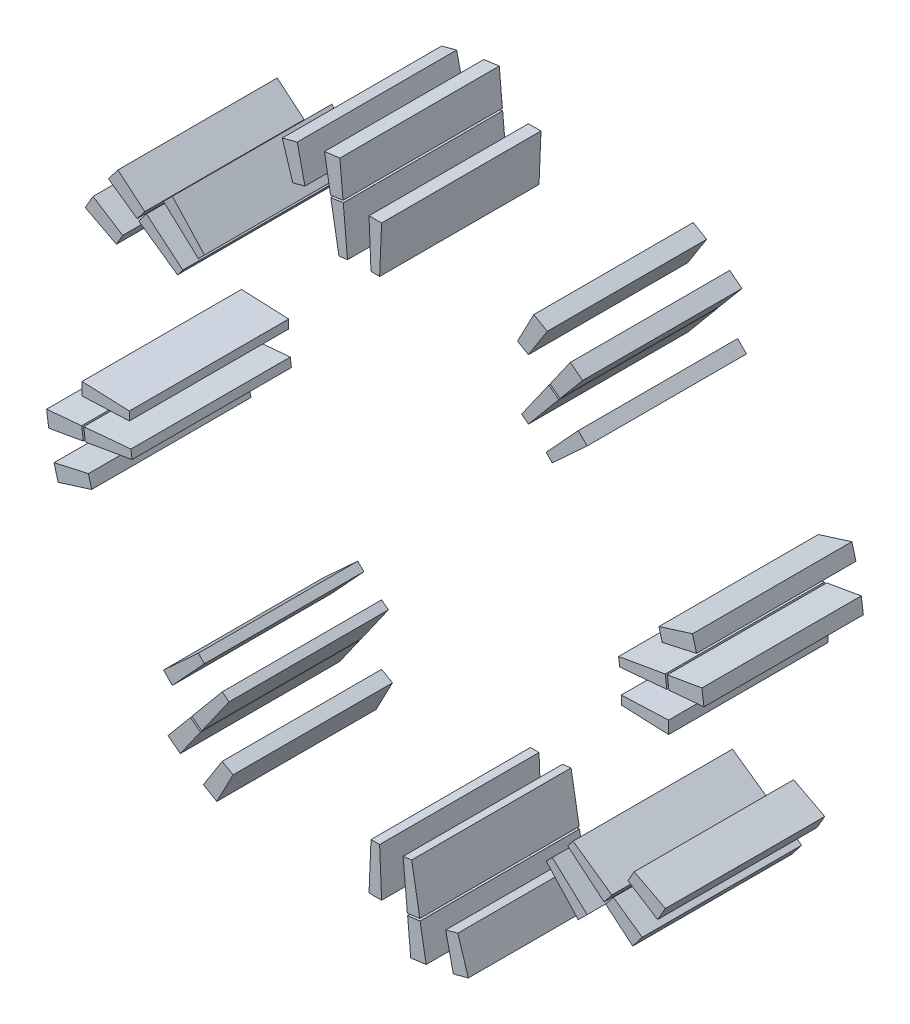
from build123d import *

# Parameters (mm, degrees)
SLOT_COPPER_ENVELOPES_START    = -15
SLOT_COPPER_ENVELOPES_DEPTH    = 30
SLOT_COPPER_ENVELOPES_2_DEPTH  = 30
SLOT_COPPER_ENVELOPES_3_DEPTH  = 30
SLOT_COPPER_ENVELOPES_4_DEPTH  = 30
SLOT_COPPER_ENVELOPES_5_DEPTH  = 30
SLOT_COPPER_ENVELOPES_6_DEPTH  = 30
SLOT_COPPER_ENVELOPES_7_DEPTH  = 30
SLOT_COPPER_ENVELOPES_8_DEPTH  = 30
SLOT_COPPER_ENVELOPES_9_DEPTH  = 30
SLOT_COPPER_ENVELOPES_10_DEPTH = 30
SLOT_COPPER_ENVELOPES_11_DEPTH = 30
SLOT_COPPER_ENVELOPES_12_DEPTH = 30
SLOT_COPPER_ENVELOPES_13_DEPTH = 30
SLOT_COPPER_ENVELOPES_14_DEPTH = 30
SLOT_COPPER_ENVELOPES_15_DEPTH = 30
SLOT_COPPER_ENVELOPES_16_DEPTH = 30
SLOT_COPPER_ENVELOPES_17_DEPTH = 30
SLOT_COPPER_ENVELOPES_18_DEPTH = 30
SLOT_COPPER_ENVELOPES_19_DEPTH = 30
SLOT_COPPER_ENVELOPES_20_DEPTH = 30
SLOT_COPPER_ENVELOPES_21_DEPTH = 30
SLOT_COPPER_ENVELOPES_22_DEPTH = 30
SLOT_COPPER_ENVELOPES_23_DEPTH = 30
SLOT_COPPER_ENVELOPES_24_DEPTH = 30
SLOT_COPPER_ENVELOPES_25_DEPTH = 30
SLOT_COPPER_ENVELOPES_26_DEPTH = 30
SLOT_COPPER_ENVELOPES_27_DEPTH = 30
SLOT_COPPER_ENVELOPES_28_DEPTH = 30
SLOT_COPPER_ENVELOPES_29_DEPTH = 30
SLOT_COPPER_ENVELOPES_30_DEPTH = 30
SLOT_COPPER_ENVELOPES_31_DEPTH = 30
SLOT_COPPER_ENVELOPES_32_DEPTH = 30


with BuildPart() as part:
    # Эскиз1 → Slot_copper_envelopes (new body)
    with BuildSketch(Plane.XY.offset(SLOT_COPPER_ENVELOPES_START)):
        Polygon((46.292870334, -0.8125), (55.2, -1.18280303), (55.2, 1.18280303), (46.292870334, 0.8125), align=None)
    extrude(amount=SLOT_COPPER_ENVELOPES_DEPTH)


with BuildPart() as body_2:
    # Эскиз1 → Slot_copper_envelopes 2 (new body)
    with BuildSketch(Plane.XY.offset(SLOT_COPPER_ENVELOPES_START)):
        Polygon((55.266246148, 6.082929947), (61.858764934, 6.668741046), (61.476975821, 9.568717266), (54.957472596, 8.428297919), align=None)
    extrude(amount=SLOT_COPPER_ENVELOPES_2_DEPTH)


with BuildPart() as body_3:
    # Эскиз1 → Slot_copper_envelopes 3 (new body)
    with BuildSketch(Plane.XY.offset(SLOT_COPPER_ENVELOPES_START)):
        Polygon((46.002880942, 5.236883142), (54.882143124, 6.032361824), (54.573369572, 8.377729797), (45.79077588, 6.847981041), align=None)
    extrude(amount=SLOT_COPPER_ENVELOPES_3_DEPTH)


with BuildPart() as body_4:
    # Эскиз1 → Slot_copper_envelopes 4 (new body)
    with BuildSketch(Plane.XY.offset(SLOT_COPPER_ENVELOPES_START)):
        Polygon((53.999454067, 13.244582306), (60.459109249, 14.685878084), (59.702063542, 17.511211126), (53.387190165, 15.529582294), align=None)
    extrude(amount=SLOT_COPPER_ENVELOPES_4_DEPTH)


with BuildPart() as body_5:
    # Эскиз1 → Slot_copper_envelopes 5 (new body)
    with BuildSketch(Plane.XY.offset(SLOT_COPPER_ENVELOPES_START)):
        Polygon((33.308526793, 32.159478274), (39.868662365, 38.195926278), (38.195926278, 39.868662365), (32.159478274, 33.308526793), align=None)
    extrude(amount=SLOT_COPPER_ENVELOPES_5_DEPTH)


with BuildPart() as body_6:
    # Эскиз1 → Slot_copper_envelopes 6 (new body)
    with BuildSketch(Plane.XY.offset(SLOT_COPPER_ENVELOPES_START)):
        Polygon((34.777856407, 43.380418437), (39.025240145, 48.456264176), (36.704681624, 50.236891356), (32.901094937, 44.820508162), align=None)
    extrude(amount=SLOT_COPPER_ENVELOPES_6_DEPTH)


with BuildPart() as body_7:
    # Эскиз1 → Slot_copper_envelopes 7 (new body)
    with BuildSketch(Plane.XY.offset(SLOT_COPPER_ENVELOPES_START)):
        Polygon((28.825913486, 36.23198465), (34.542011616, 43.073059521), (32.665250146, 44.513149247), (27.536714308, 37.221221972), align=None)
    extrude(amount=SLOT_COPPER_ENVELOPES_7_DEPTH)


with BuildPart() as body_8:
    # Эскиз1 → Slot_copper_envelopes 8 (new body)
    with BuildSketch(Plane.XY.offset(SLOT_COPPER_ENVELOPES_START)):
        Polygon((28.818046189, 47.548714114), (32.366562153, 53.135530115), (29.833437847, 54.598030115), (26.769371245, 48.731517144), align=None)
    extrude(amount=SLOT_COPPER_ENVELOPES_8_DEPTH)


with BuildPart() as body_9:
    # Эскиз1 → Slot_copper_envelopes 9 (new body)
    with BuildSketch(Plane.XY.offset(SLOT_COPPER_ENVELOPES_START)):
        Polygon((0.8125, 46.292870334), (1.18280303, 55.2), (-1.18280303, 55.2), (-0.8125, 46.292870334), align=None)
    extrude(amount=SLOT_COPPER_ENVELOPES_9_DEPTH)


with BuildPart() as body_10:
    # Эскиз1 → Slot_copper_envelopes 10 (new body)
    with BuildSketch(Plane.XY.offset(SLOT_COPPER_ENVELOPES_START)):
        Polygon((-6.082929947, 55.266246148), (-6.668741046, 61.858764934), (-9.568717266, 61.476975821), (-8.428297919, 54.957472596), align=None)
    extrude(amount=SLOT_COPPER_ENVELOPES_10_DEPTH)


with BuildPart() as body_11:
    # Эскиз1 → Slot_copper_envelopes 11 (new body)
    with BuildSketch(Plane.XY.offset(SLOT_COPPER_ENVELOPES_START)):
        Polygon((-5.236883142, 46.002880942), (-6.032361824, 54.882143124), (-8.377729797, 54.573369572), (-6.847981041, 45.79077588), align=None)
    extrude(amount=SLOT_COPPER_ENVELOPES_11_DEPTH)


with BuildPart() as body_12:
    # Эскиз1 → Slot_copper_envelopes 12 (new body)
    with BuildSketch(Plane.XY.offset(SLOT_COPPER_ENVELOPES_START)):
        Polygon((-13.244582306, 53.999454067), (-14.685878084, 60.459109249), (-17.511211126, 59.702063542), (-15.529582294, 53.387190165), align=None)
    extrude(amount=SLOT_COPPER_ENVELOPES_12_DEPTH)


with BuildPart() as body_13:
    # Эскиз1 → Slot_copper_envelopes 13 (new body)
    with BuildSketch(Plane.XY.offset(SLOT_COPPER_ENVELOPES_START)):
        Polygon((-32.159478274, 33.308526793), (-38.195926278, 39.868662365), (-39.868662365, 38.195926278), (-33.308526793, 32.159478274), align=None)
    extrude(amount=SLOT_COPPER_ENVELOPES_13_DEPTH)


with BuildPart() as body_14:
    # Эскиз1 → Slot_copper_envelopes 14 (new body)
    with BuildSketch(Plane.XY.offset(SLOT_COPPER_ENVELOPES_START)):
        Polygon((-43.380418437, 34.777856407), (-48.456264176, 39.025240145), (-50.236891356, 36.704681624), (-44.820508162, 32.901094937), align=None)
    extrude(amount=SLOT_COPPER_ENVELOPES_14_DEPTH)


with BuildPart() as body_15:
    # Эскиз1 → Slot_copper_envelopes 15 (new body)
    with BuildSketch(Plane.XY.offset(SLOT_COPPER_ENVELOPES_START)):
        Polygon((-36.23198465, 28.825913486), (-43.073059521, 34.542011616), (-44.513149247, 32.665250146), (-37.221221972, 27.536714308), align=None)
    extrude(amount=SLOT_COPPER_ENVELOPES_15_DEPTH)


with BuildPart() as body_16:
    # Эскиз1 → Slot_copper_envelopes 16 (new body)
    with BuildSketch(Plane.XY.offset(SLOT_COPPER_ENVELOPES_START)):
        Polygon((-47.548714114, 28.818046189), (-53.135530115, 32.366562153), (-54.598030115, 29.833437847), (-48.731517144, 26.769371245), align=None)
    extrude(amount=SLOT_COPPER_ENVELOPES_16_DEPTH)


with BuildPart() as body_17:
    # Эскиз1 → Slot_copper_envelopes 17 (new body)
    with BuildSketch(Plane.XY.offset(SLOT_COPPER_ENVELOPES_START)):
        Polygon((-46.292870334, 0.8125), (-55.2, 1.18280303), (-55.2, -1.18280303), (-46.292870334, -0.8125), align=None)
    extrude(amount=SLOT_COPPER_ENVELOPES_17_DEPTH)


with BuildPart() as body_18:
    # Эскиз1 → Slot_copper_envelopes 18 (new body)
    with BuildSketch(Plane.XY.offset(SLOT_COPPER_ENVELOPES_START)):
        Polygon((-55.266246148, -6.082929947), (-61.858764934, -6.668741046), (-61.476975821, -9.568717266), (-54.957472596, -8.428297919), align=None)
    extrude(amount=SLOT_COPPER_ENVELOPES_18_DEPTH)


with BuildPart() as body_19:
    # Эскиз1 → Slot_copper_envelopes 19 (new body)
    with BuildSketch(Plane.XY.offset(SLOT_COPPER_ENVELOPES_START)):
        Polygon((-46.002880942, -5.236883142), (-54.882143124, -6.032361824), (-54.573369572, -8.377729797), (-45.79077588, -6.847981041), align=None)
    extrude(amount=SLOT_COPPER_ENVELOPES_19_DEPTH)


with BuildPart() as body_20:
    # Эскиз1 → Slot_copper_envelopes 20 (new body)
    with BuildSketch(Plane.XY.offset(SLOT_COPPER_ENVELOPES_START)):
        Polygon((-53.999454067, -13.244582306), (-60.459109249, -14.685878084), (-59.702063542, -17.511211126), (-53.387190165, -15.529582294), align=None)
    extrude(amount=SLOT_COPPER_ENVELOPES_20_DEPTH)


with BuildPart() as body_21:
    # Эскиз1 → Slot_copper_envelopes 21 (new body)
    with BuildSketch(Plane.XY.offset(SLOT_COPPER_ENVELOPES_START)):
        Polygon((-33.308526793, -32.159478274), (-39.868662365, -38.195926278), (-38.195926278, -39.868662365), (-32.159478274, -33.308526793), align=None)
    extrude(amount=SLOT_COPPER_ENVELOPES_21_DEPTH)


with BuildPart() as body_22:
    # Эскиз1 → Slot_copper_envelopes 22 (new body)
    with BuildSketch(Plane.XY.offset(SLOT_COPPER_ENVELOPES_START)):
        Polygon((-34.777856407, -43.380418437), (-39.025240145, -48.456264176), (-36.704681624, -50.236891356), (-32.901094937, -44.820508162), align=None)
    extrude(amount=SLOT_COPPER_ENVELOPES_22_DEPTH)


with BuildPart() as body_23:
    # Эскиз1 → Slot_copper_envelopes 23 (new body)
    with BuildSketch(Plane.XY.offset(SLOT_COPPER_ENVELOPES_START)):
        Polygon((-28.825913486, -36.23198465), (-34.542011616, -43.073059521), (-32.665250146, -44.513149247), (-27.536714308, -37.221221972), align=None)
    extrude(amount=SLOT_COPPER_ENVELOPES_23_DEPTH)


with BuildPart() as body_24:
    # Эскиз1 → Slot_copper_envelopes 24 (new body)
    with BuildSketch(Plane.XY.offset(SLOT_COPPER_ENVELOPES_START)):
        Polygon((-28.818046189, -47.548714114), (-32.366562153, -53.135530115), (-29.833437847, -54.598030115), (-26.769371245, -48.731517144), align=None)
    extrude(amount=SLOT_COPPER_ENVELOPES_24_DEPTH)


with BuildPart() as body_25:
    # Эскиз1 → Slot_copper_envelopes 25 (new body)
    with BuildSketch(Plane.XY.offset(SLOT_COPPER_ENVELOPES_START)):
        Polygon((-0.8125, -46.292870334), (-1.18280303, -55.2), (1.18280303, -55.2), (0.8125, -46.292870334), align=None)
    extrude(amount=SLOT_COPPER_ENVELOPES_25_DEPTH)


with BuildPart() as body_26:
    # Эскиз1 → Slot_copper_envelopes 26 (new body)
    with BuildSketch(Plane.XY.offset(SLOT_COPPER_ENVELOPES_START)):
        Polygon((6.082929947, -55.266246148), (6.668741046, -61.858764934), (9.568717266, -61.476975821), (8.428297919, -54.957472596), align=None)
    extrude(amount=SLOT_COPPER_ENVELOPES_26_DEPTH)


with BuildPart() as body_27:
    # Эскиз1 → Slot_copper_envelopes 27 (new body)
    with BuildSketch(Plane.XY.offset(SLOT_COPPER_ENVELOPES_START)):
        Polygon((5.236883142, -46.002880942), (6.032361824, -54.882143124), (8.377729797, -54.573369572), (6.847981041, -45.79077588), align=None)
    extrude(amount=SLOT_COPPER_ENVELOPES_27_DEPTH)


with BuildPart() as body_28:
    # Эскиз1 → Slot_copper_envelopes 28 (new body)
    with BuildSketch(Plane.XY.offset(SLOT_COPPER_ENVELOPES_START)):
        Polygon((13.244582306, -53.999454067), (14.685878084, -60.459109249), (17.511211126, -59.702063542), (15.529582294, -53.387190165), align=None)
    extrude(amount=SLOT_COPPER_ENVELOPES_28_DEPTH)


with BuildPart() as body_29:
    # Эскиз1 → Slot_copper_envelopes 29 (new body)
    with BuildSketch(Plane.XY.offset(SLOT_COPPER_ENVELOPES_START)):
        Polygon((32.159478274, -33.308526793), (38.195926278, -39.868662365), (39.868662365, -38.195926278), (33.308526793, -32.159478274), align=None)
    extrude(amount=SLOT_COPPER_ENVELOPES_29_DEPTH)


with BuildPart() as body_30:
    # Эскиз1 → Slot_copper_envelopes 30 (new body)
    with BuildSketch(Plane.XY.offset(SLOT_COPPER_ENVELOPES_START)):
        Polygon((43.380418437, -34.777856407), (48.456264176, -39.025240145), (50.236891356, -36.704681624), (44.820508162, -32.901094937), align=None)
    extrude(amount=SLOT_COPPER_ENVELOPES_30_DEPTH)


with BuildPart() as body_31:
    # Эскиз1 → Slot_copper_envelopes 31 (new body)
    with BuildSketch(Plane.XY.offset(SLOT_COPPER_ENVELOPES_START)):
        Polygon((36.23198465, -28.825913486), (43.073059521, -34.542011616), (44.513149247, -32.665250146), (37.221221972, -27.536714308), align=None)
    extrude(amount=SLOT_COPPER_ENVELOPES_31_DEPTH)


with BuildPart() as body_32:
    # Эскиз1 → Slot_copper_envelopes 32 (new body)
    with BuildSketch(Plane.XY.offset(SLOT_COPPER_ENVELOPES_START)):
        Polygon((47.548714114, -28.818046189), (53.135530115, -32.366562153), (54.598030115, -29.833437847), (48.731517144, -26.769371245), align=None)
    extrude(amount=SLOT_COPPER_ENVELOPES_32_DEPTH)


solid = Compound([part.part, body_2.part, body_3.part, body_4.part, body_5.part, body_6.part, body_7.part, body_8.part, body_9.part, body_10.part, body_11.part, body_12.part, body_13.part, body_14.part, body_15.part, body_16.part, body_17.part, body_18.part, body_19.part, body_20.part, body_21.part, body_22.part, body_23.part, body_24.part, body_25.part, body_26.part, body_27.part, body_28.part, body_29.part, body_30.part, body_31.part, body_32.part])
